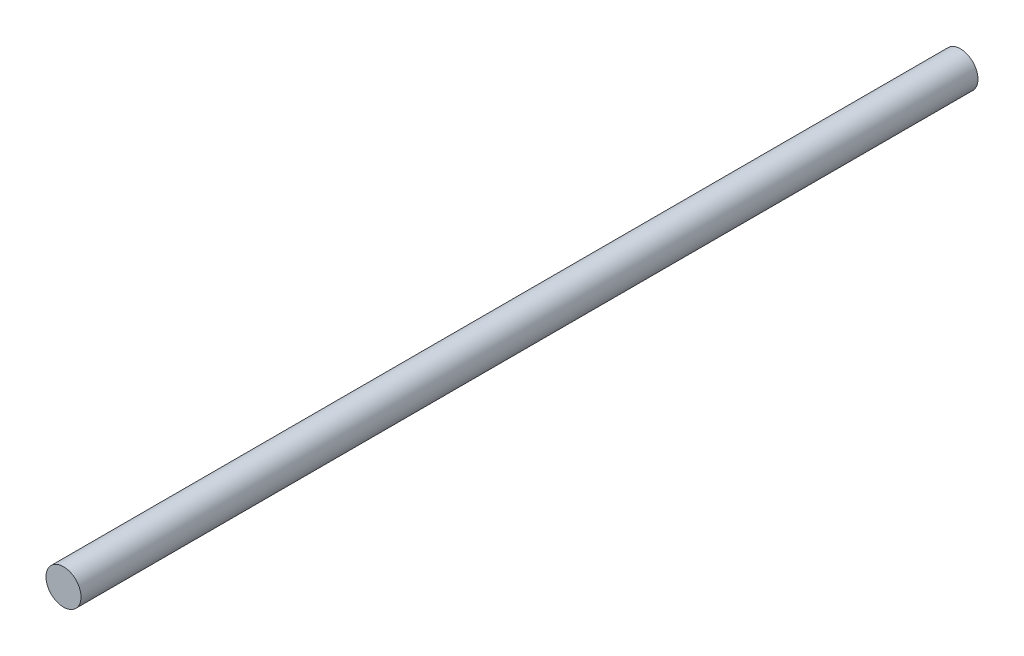
from build123d import *

# Parameters (mm, degrees)
CROQUIS1_R              = 12.7
SALIENTE_EXTRUIR1_DEPTH = 650


with BuildPart() as part:
    # Croquis1 → Saliente-Extruir1 (new body)
    with BuildSketch(Plane.XY):
        Circle(CROQUIS1_R)
    extrude(amount=SALIENTE_EXTRUIR1_DEPTH)


solid = part.part
